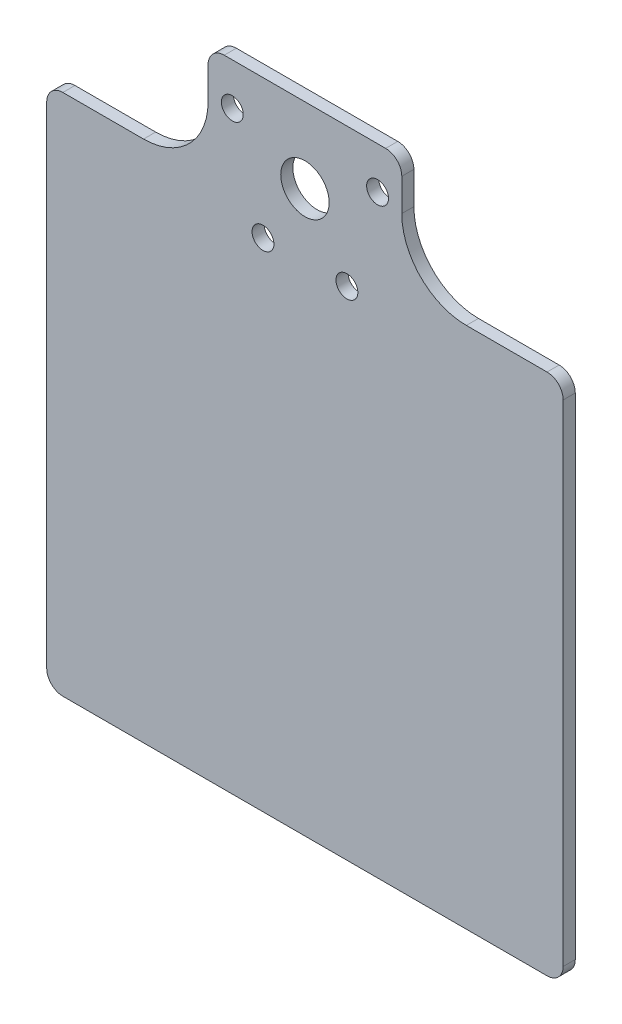
from build123d import *

# Parameters (mm, degrees)
SKETCH1_W                 = 38.1
SKETCH1_H                 = 34.925
BOSS_EXTRUDE1_DEPTH       = 2.38125
SKETCH5_W                 = 101.6
SKETCH5_H                 = 90.17
BOSS_EXTRUDE2_DEPTH       = 2.38125
CUT_EXTRUDE2_REACH        = 121.042
SKETCH6_R                 = 4.7625
F_8_CLEARANCE_HOLE1_D     = 4.3053
F_8_CLEARANCE_HOLE1_DEPTH = 12.7
F_8_CLEARANCE_HOLE1_TIP   = 1.293442612
SKETCH11_W                = 31.75
SKETCH11_H                = 12.7
BOSS_EXTRUDE3_DEPTH       = 2.38125
FILLET3_R                 = 3.175
FILLET4_R                 = 12.7


with BuildPart() as part:
    # Sketch1 → Boss-Extrude1 (new body)
    with BuildSketch(Plane.XY):
        Rectangle(SKETCH1_W, SKETCH1_H)
    extrude(amount=BOSS_EXTRUDE1_DEPTH)

    # Sketch5 → Boss-Extrude2 (add)
    with BuildSketch(Plane.XY.offset(2.38125)):
        with Locations((0, -62.5475)):
            Rectangle(SKETCH5_W, SKETCH5_H)
    extrude(amount=-BOSS_EXTRUDE2_DEPTH)

    # Sketch6 → Cut-Extrude2 (cut, up to next)
    with BuildSketch(Plane(origin=(0, 0, 0), x_dir=(-1, 0, 0), z_dir=(0, 0, -1)), mode=Mode.PRIVATE) as cut_extrude2_sk1:
        with Locations((0, 2.6543)):
            Circle(SKETCH6_R)
    cut_extrude2_tool1 = extrude(cut_extrude2_sk1.sketch, amount=-CUT_EXTRUDE2_REACH, mode=Mode.PRIVATE) & part.part
    add(cut_extrude2_tool1.solids().sort_by_distance((0, 2.6543, 0))[0], mode=Mode.SUBTRACT)

    # #8 Clearance Hole1
    with Locations(Plane(origin=(0, 0, 0), x_dir=(-1, 0, 0), z_dir=(0, 0, -1))):
        with Locations((-8.255, -9.8425), (8.255, -9.8425), (-14.2875, 9.2075), (14.2875, 9.2075)):
            Hole(F_8_CLEARANCE_HOLE1_D / 2, depth=F_8_CLEARANCE_HOLE1_DEPTH)
            with Locations((0, 0, -(F_8_CLEARANCE_HOLE1_DEPTH + F_8_CLEARANCE_HOLE1_TIP / 2))):  # 118° drill point
                Cone(0, F_8_CLEARANCE_HOLE1_D / 2, F_8_CLEARANCE_HOLE1_TIP, mode=Mode.SUBTRACT)

    # Sketch11 → Boss-Extrude3 (add)
    with BuildSketch(Plane.XY.offset(2.38125)):
        with Locations((-34.925, -11.1125)):
            Rectangle(SKETCH11_W, SKETCH11_H)
        with Locations((34.925, -11.1125)):
            Rectangle(SKETCH11_W, SKETCH11_H)
    extrude(amount=-BOSS_EXTRUDE3_DEPTH)

    # Fillet3
    fillet3_edges = [part.edges().sort_by_distance(p)[0] for p in [
        (-50.8, -107.6325, 1.190625),
        (50.8, -107.6325, 1.190625),
        (-19.05, 17.4625, 1.190625),
        (19.05, 17.4625, 1.190625),
        (50.8, -4.7625, 1.190625),
        (-50.8, -4.7625, 1.190625),
    ]]
    fillet(fillet3_edges, radius=FILLET3_R)

    # Fillet4
    fillet4_edges = [part.edges().sort_by_distance(p)[0] for p in [
        (19.05, -4.7625, 1.190625),
        (-19.05, -4.7625, 1.190625),
    ]]
    fillet(fillet4_edges, radius=FILLET4_R)


solid = part.part
